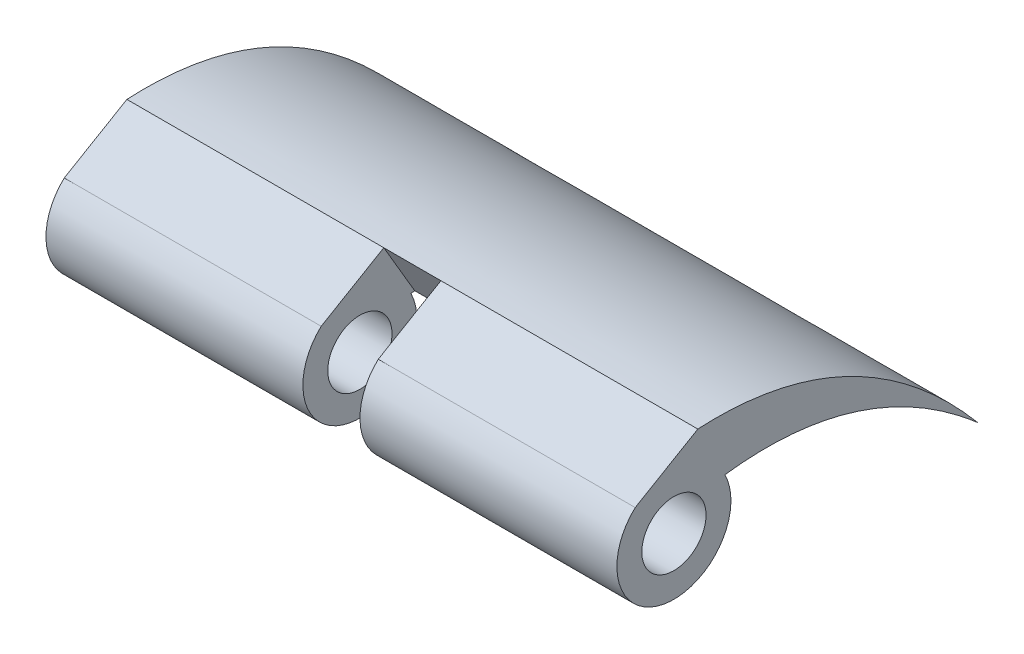
from build123d import *

# Parameters (mm, degrees)
SKETCH1_R           = 0.9
BOSS_EXTRUDE1_DEPTH = 16
SKETCH2_W           = 1.6
SKETCH2_H           = 4.200659695
CUT_EXTRUDE1_DEPTH  = 10


with BuildPart() as part:
    # Sketch1 → Boss-Extrude1 (new body)
    with BuildSketch(Plane(origin=(0, 0, 0), x_dir=(0, 0, -1), z_dir=(1, 0, 0))):
        with BuildLine():
            Line((-1.084501086, 1.173366689), (0.669981536, 2.201916273))
            add(Edge.make_bspline(
                [(0.669981536, 2.201916273), (5.142012003, 2.441554719), (8.521732168, -1.570541081)],
                knots=[0, 0, 0, 1, 1, 1], degree=2))
            add(Edge.make_bspline(
                [(1.429892444, 0.712979376), (5.328809075, 1.211697848), (8.521732168, -1.570541081)],
                knots=[0, 0, 0, 1, 1, 1], degree=2))
            ThreePointArc((1.429892444, 0.712979376), (-0.287772336, -1.571661247), (-1.084501086, 1.173366689))
        make_face()
        Circle(SKETCH1_R, mode=Mode.SUBTRACT)
    extrude(amount=BOSS_EXTRUDE1_DEPTH)

    # Sketch2 → Cut-Extrude1 (cut)
    with BuildSketch(Plane(origin=(0, 1.346412624, 0.789322234), x_dir=(1, 0, 0), z_dir=(0, 0.8626851476678137, 0.5057413726336444))):
        with Locations((8, -0.408746569)):
            Rectangle(SKETCH2_W, SKETCH2_H)
    extrude(amount=-CUT_EXTRUDE1_DEPTH, mode=Mode.SUBTRACT)


solid = part.part
